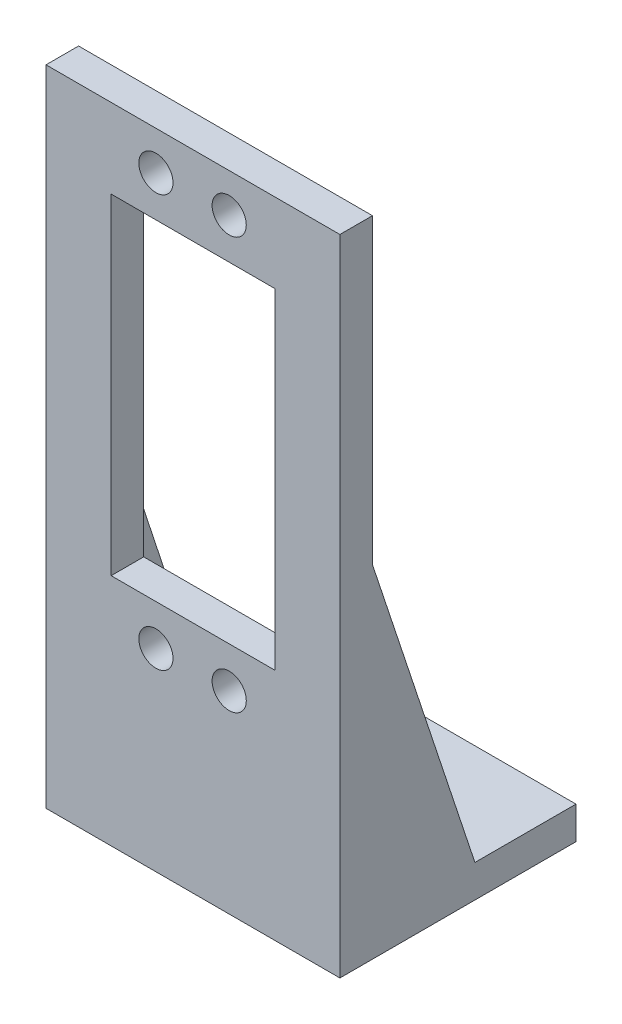
from build123d import *

# Parameters (mm, degrees)
SKETCH1_W           = 36.1
SKETCH1_H           = 75.1
SKETCH1_W_2         = 20.1
SKETCH1_H_2         = 40.6
BOSS_EXTRUDE1_DEPTH = 4
SKETCH3_W           = 36.1
SKETCH3_H           = 4
BOSS_EXTRUDE3_DEPTH = 29
BOSS_EXTRUDE4_DEPTH = 4
BOSS_EXTRUDE5_DEPTH = 4
SKETCH12_R          = 2
CUT_EXTRUDE2_DEPTH  = 4
SKETCH16_R          = 2.1
CUT_EXTRUDE3_DEPTH  = 61.382199364


with BuildPart() as part:
    # Sketch1 → Boss-Extrude1 (new body)
    with BuildSketch(Plane.XY):
        with Locations((-2.05, -7.45)):
            Rectangle(SKETCH1_W, SKETCH1_H)
        with Locations((-2.05, 0.05)):
            Rectangle(SKETCH1_W_2, SKETCH1_H_2, mode=Mode.SUBTRACT)
    extrude(amount=BOSS_EXTRUDE1_DEPTH)

    # Sketch3 → Boss-Extrude3 (add)
    with BuildSketch(Plane.XY.offset(4)):
        with Locations((-2.05, -47)):
            Rectangle(SKETCH3_W, SKETCH3_H)
    extrude(amount=-BOSS_EXTRUDE3_DEPTH)

    # Sketch9 → Boss-Extrude4 (add)
    with BuildSketch(Plane(origin=(16, 0, 0), x_dir=(0, 0, -1), z_dir=(1, 0, 0))):
        Polygon((0, -7.031601619), (12.585734956, -45), (0, -45), align=None)
    extrude(amount=-BOSS_EXTRUDE4_DEPTH)

    # Sketch11 → Boss-Extrude5 (add)
    with BuildSketch(Plane.ZY.offset(20.1)):
        Polygon((-12.5, -45), (0, -7.003289616), (0, -45), align=None)
    extrude(amount=-BOSS_EXTRUDE5_DEPTH)

    # Sketch12 → Cut-Extrude2 (cut)
    with BuildSketch(Plane(origin=(0, -45, 0), x_dir=(1, 0, 0), z_dir=(0, 1, 0))):
        with Locations(Location((2.57967866, 17.122546138, 0), (0, 0, 270))):
            Circle(SKETCH12_R)
        with Locations(Location((-6.551547439, 7.935229344, 0), (0, 0, 270))):
            Circle(SKETCH12_R)
    extrude(amount=-CUT_EXTRUDE2_DEPTH, mode=Mode.SUBTRACT)

    # Sketch16 → Cut-Extrude3 (cut, through all)
    with BuildSketch(Plane.XY.offset(4)):
        with Locations((-6.6, 25.35)):
            Circle(SKETCH16_R)
        with Locations((2.4, 25.35)):
            Circle(SKETCH16_R)
        with Locations((-6.6, -25.25)):
            Circle(SKETCH16_R)
        with Locations((2.4, -25.25)):
            Circle(SKETCH16_R)
    extrude(amount=-CUT_EXTRUDE3_DEPTH, mode=Mode.SUBTRACT)


solid = part.part
